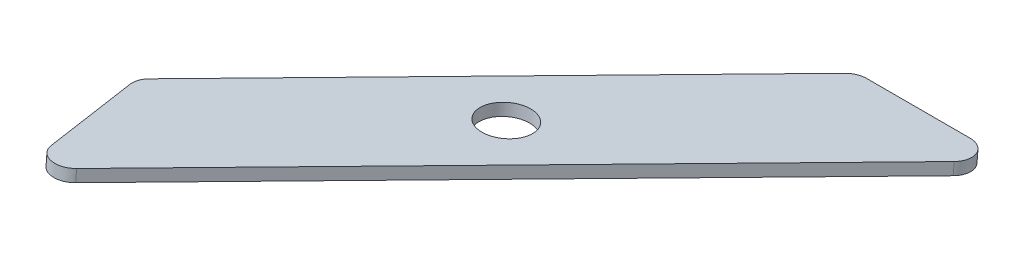
from build123d import *

# Parameters (mm, degrees)
SKETCH2_R           = 3.2639
BOSS_EXTRUDE1_DEPTH = 1.5875
FILLET1_R           = 2.54


with BuildPart() as part:
    # Sketch2 → Boss-Extrude1 (new body)
    with BuildSketch(Plane(origin=(0, 55.360225049, -4.608794225), x_dir=(-1, 0, 0), z_dir=(1.3350431871117514e-14, -0.9965525450230818, 0.0829639982644206))):
        Polygon((255.547712488, -35.085636701), (314.736370081, -108.545763081), (319.072942794, -88.62551032), (275.934530116, -35.085636701), align=None)
        with Locations((291.32288887, -66.835636701)):
            Circle(SKETCH2_R, mode=Mode.SUBTRACT)
    extrude(amount=BOSS_EXTRUDE1_DEPTH)

    # Fillet1
    fillet1_edges = [part.edges().sort_by_distance(p)[0] for p in [
        (-275.934530116, 57.480056169, 30.421738996),
        (-255.547712488, 57.480056169, 30.421738996),
        (-319.072942794, 61.921938151, 83.777036311),
        (-314.736370081, 63.574601966, 103.628614898),
    ]]
    fillet(fillet1_edges, radius=FILLET1_R)


solid = part.part
